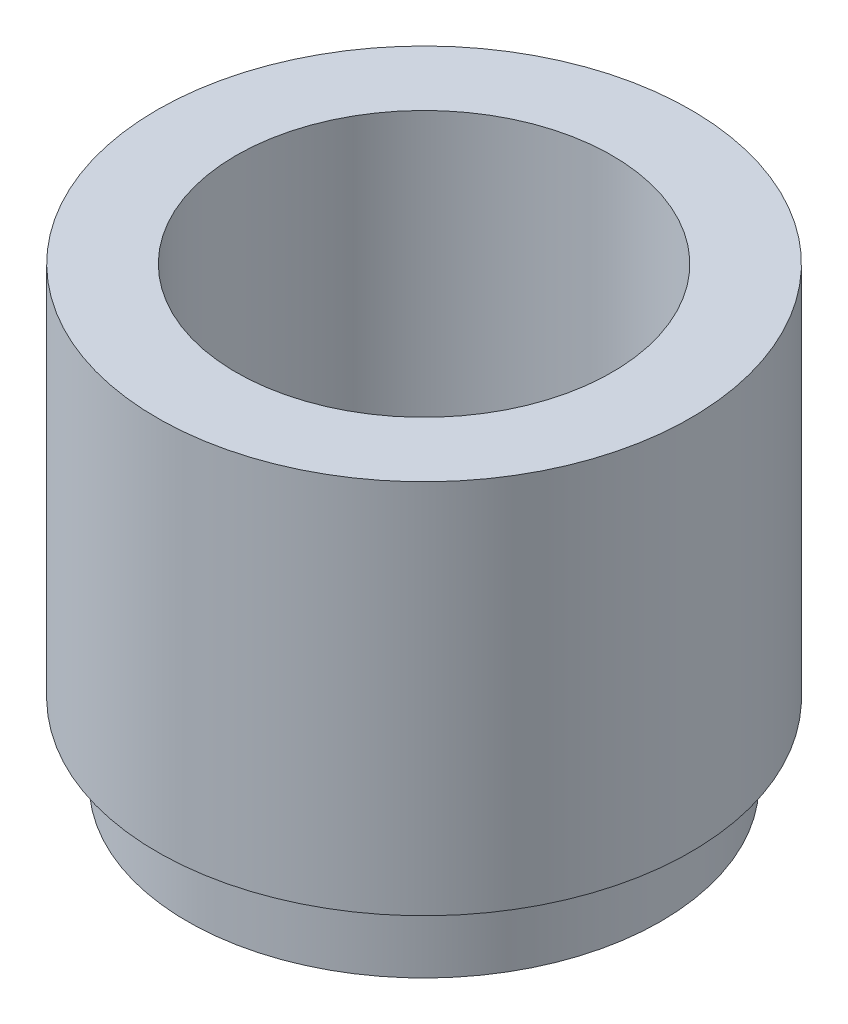
from build123d import *


with BuildPart() as part:
    # Sketch1 → Revolve1 (revolve)
    with BuildSketch(Plane.XY, mode=Mode.PRIVATE) as revolve1_sk:
        Polygon((2.5, 0), (3.15, 0), (3.15, 1), (3.55, 1), (3.55, 6), (2.5, 6), align=None)
    revolve(revolve1_sk.sketch.rotate(Axis((0, 6, 0), (0, -1, 0)), 180), axis=Axis((0, 6, 0), (0, -1, 0)))


solid = part.part
